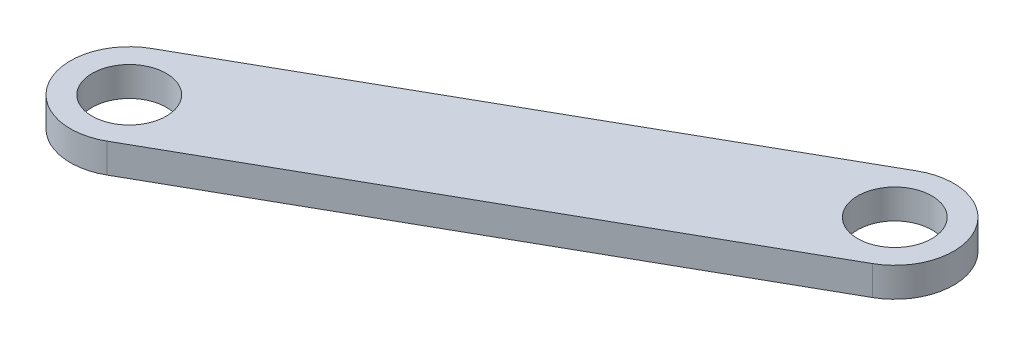
from build123d import *

# Parameters (mm, degrees)
SKETCH1_R           = 2
BOSS_EXTRUDE1_DEPTH = 1.5875


with BuildPart() as part:
    # Sketch1 → Boss-Extrude1 (new body)
    with BuildSketch(Plane(origin=(0, 0, 0), x_dir=(1, 0, 0), z_dir=(0, 1, 0))):
        with BuildLine():
            Line((1.564021986, -2.763052701), (-24.798557496, -17.685552701))
            ThreePointArc((-24.798557496, -17.685552701), (-29.125632183, -16.486521986), (-27.926601468, -12.159447299))
            Line((-27.926601468, -12.159447299), (-1.564021986, 2.763052701))
            ThreePointArc((-1.564021986, 2.763052701), (2.763052701, 1.564021986), (1.564021986, -2.763052701))
        make_face()
        with Locations(Location((0, 0, 0), (0, 0, 270))):
            Circle(SKETCH1_R, mode=Mode.SUBTRACT)
        with Locations(Location((-26.362579482, -14.9225, 0), (0, 0, 270))):
            Circle(SKETCH1_R, mode=Mode.SUBTRACT)
    extrude(amount=-BOSS_EXTRUDE1_DEPTH)


solid = part.part
